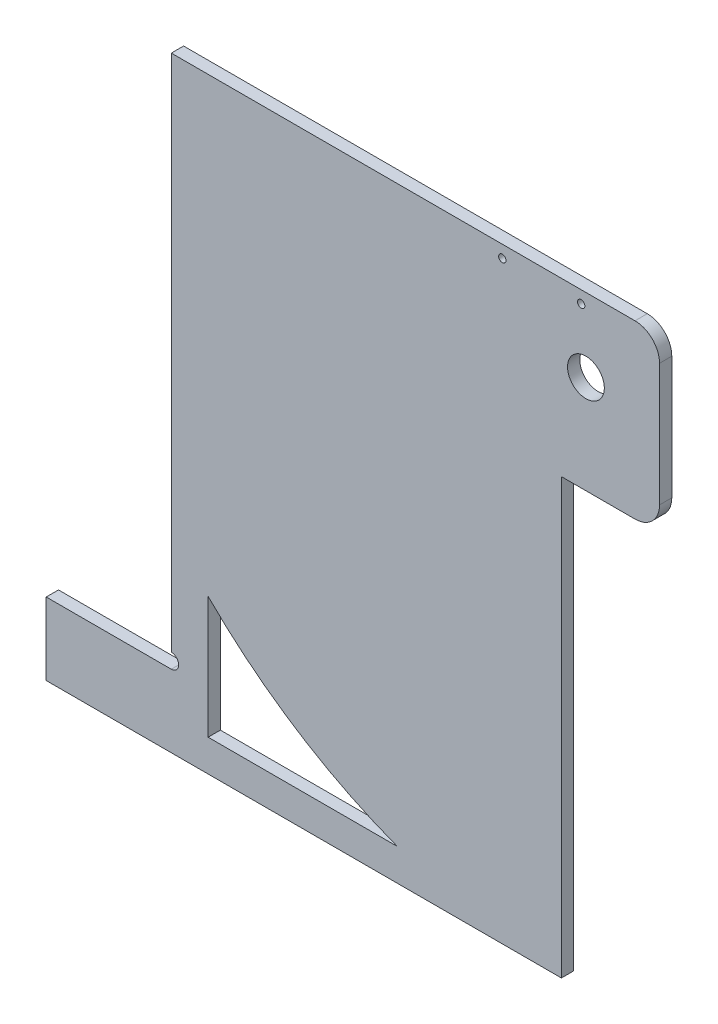
from build123d import *

# Parameters (mm, degrees)
EXTRUDE_1_DEPTH     = 5
SKETCH_2_R          = 7.5
CUT_EXTRUDE_1_DEPTH = 5
SKETCH_3_W          = 5
SKETCH_3_H          = 6
CUT_EXTRUDE_3_DEPTH = 51
CUT_EXTRUDE_4_REACH = 353.474
CUT_EXTRUDE_6_REACH = 353.474
SKETCH_6_R          = 1.5
CUT_EXTRUDE_7_REACH = 353.474
SKETCH_7_W          = 51
SKETCH_7_H          = 217.5
CUT_EXTRUDE_9_DEPTH = 10


with BuildPart() as part:
    # 草图1 → 凸台-拉伸1 (new body)
    with BuildSketch(Plane.XY):
        with BuildLine():
            Line((210, -247), (210, -237))
            Line((210, -237), (210, -70))
            Line((210, -70), (210, 0))
            Line((210, 0), (10, 0))
            ThreePointArc((10, 0), (2.928932188, -2.928932188), (0, -10))
            Line((0, -10), (0, -237))
            Line((0, -237), (0, -247))
            Line((0, -247), (10, -247))
            Line((10, -247), (200, -247))
            Line((200, -247), (210, -247))
        make_face()
        with BuildLine():
            Line((210, 0), (210, -70))
            Line((210, -70), (240, -70))
            ThreePointArc((240, -70), (247.071067812, -67.071067812), (250, -60))
            Line((250, -60), (250, -10))
            ThreePointArc((250, -10), (247.071067812, -2.928932188), (240, 0))
            Line((240, 0), (210, 0))
        make_face()
    extrude(amount=EXTRUDE_1_DEPTH)

    # 草图2 → 切除-拉伸1 (cut)
    with BuildSketch(Plane.XY.offset(5)):
        with Locations((220, -30)):
            Circle(SKETCH_2_R)
    extrude(amount=-CUT_EXTRUDE_1_DEPTH, mode=Mode.SUBTRACT)

    # 草图3 → 切除-拉伸3 (cut)
    with BuildSketch(Plane.ZY):
        with Locations((2.5, -214.5)):
            Rectangle(SKETCH_3_W, SKETCH_3_H)
    extrude(amount=-CUT_EXTRUDE_3_DEPTH, mode=Mode.SUBTRACT)

    # 草图4 → 切除-拉伸4 (cut, up to next)
    with BuildSketch(Plane.XY.offset(5), mode=Mode.PRIVATE) as cut_extrude_4_sk1:
        with BuildLine():
            Line((51, -211.5), (51, -217.5))
            ThreePointArc((51, -217.5), (54, -214.5), (51, -211.5))
        make_face()
    cut_extrude_4_tool1 = extrude(cut_extrude_4_sk1.sketch, amount=-CUT_EXTRUDE_4_REACH, mode=Mode.PRIVATE) & part.part
    add(cut_extrude_4_tool1.solids().sort_by_distance((52.27324, -214.5, 5))[0], mode=Mode.SUBTRACT)

    # 草图6 → 切除-拉伸6 (cut, up to next)
    with BuildSketch(Plane.XY.offset(5), mode=Mode.PRIVATE) as cut_extrude_6_sk1:
        with Locations((218.076993274, -5)):
            Circle(SKETCH_6_R)
    cut_extrude_6_tool1 = extrude(cut_extrude_6_sk1.sketch, amount=-CUT_EXTRUDE_6_REACH, mode=Mode.PRIVATE) & part.part
    # 草图6 → 切除-拉伸6 (cut, up to next)
    with BuildSketch(Plane.XY.offset(5), mode=Mode.PRIVATE) as cut_extrude_6_sk2:
        with Locations((185.921620837, -5)):
            Circle(SKETCH_6_R)
    cut_extrude_6_tool2 = extrude(cut_extrude_6_sk2.sketch, amount=-CUT_EXTRUDE_6_REACH, mode=Mode.PRIVATE) & part.part
    add(cut_extrude_6_tool1.solids().sort_by_distance((218.076993, -5, 5))[0], mode=Mode.SUBTRACT)
    add(cut_extrude_6_tool2.solids().sort_by_distance((185.921621, -5, 5))[0], mode=Mode.SUBTRACT)

    # 草图7 → 切除-拉伸7 (cut, up to next)
    with BuildSketch(Plane.XY.offset(5), mode=Mode.PRIVATE) as cut_extrude_7_sk1:
        with Locations((25.5, -108.75)):
            Rectangle(SKETCH_7_W, SKETCH_7_H)
    cut_extrude_7_tool1 = extrude(cut_extrude_7_sk1.sketch, amount=-CUT_EXTRUDE_7_REACH, mode=Mode.PRIVATE) & part.part
    add(cut_extrude_7_tool1.solids().sort_by_distance((25.5, -108.75, 5))[0], mode=Mode.SUBTRACT)

    # 草图8 → 切除-拉伸9 (cut)
    with BuildSketch(Plane(origin=(0, 0, 0), x_dir=(-1, 0, 0), z_dir=(0, 0, -1))):
        with BuildLine():
            Line((-66, -234), (-66, -184.298412176))
            ThreePointArc((-66, -184.298412176), (-101.923530523, -213.253778558), (-143.136484598, -234))
            Line((-143.136484598, -234), (-66, -234))
        make_face()
    extrude(amount=-CUT_EXTRUDE_9_DEPTH, mode=Mode.SUBTRACT)


solid = part.part
